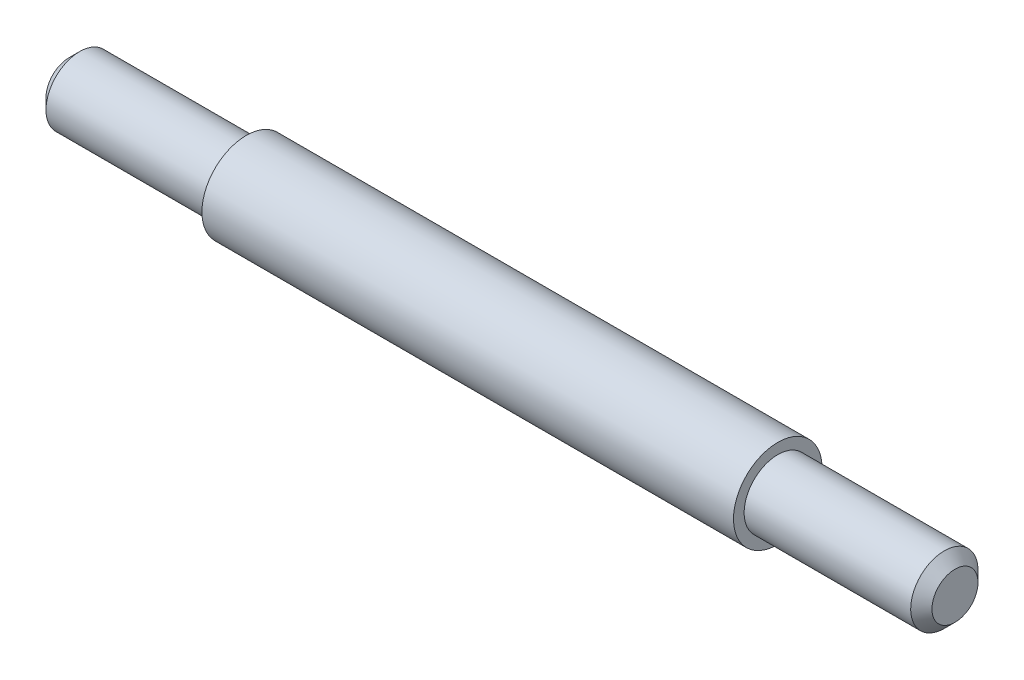
from build123d import *

# Parameters (mm, degrees)
CHAMFER1_SIZE = 0.03
CHAMFER2_SIZE = 0.03


with BuildPart() as part:
    # Sketch1 → Revolve1 (revolve)
    with BuildSketch(Plane.XY):
        Polygon((-0.75, 0.125), (0.75, 0.125), (0.75, 0.095), (1.25, 0.095), (1.25, 0), (-1.25, 0), (-1.25, 0.095), (-0.75, 0.095), align=None)
    revolve(axis=Axis((1.25, 0, 0), (-1, 0, 0)))

    # Chamfer1
    chamfer1_edges = [part.edges().sort_by_distance(p)[0] for p in [
        (-1.25, -0.095, 0),
    ]]
    chamfer(chamfer1_edges, length=CHAMFER1_SIZE)

    # Chamfer2
    chamfer2_edges = [part.edges().sort_by_distance(p)[0] for p in [
        (1.25, -0.095, 0),
    ]]
    chamfer(chamfer2_edges, length=CHAMFER2_SIZE)


solid = part.part
